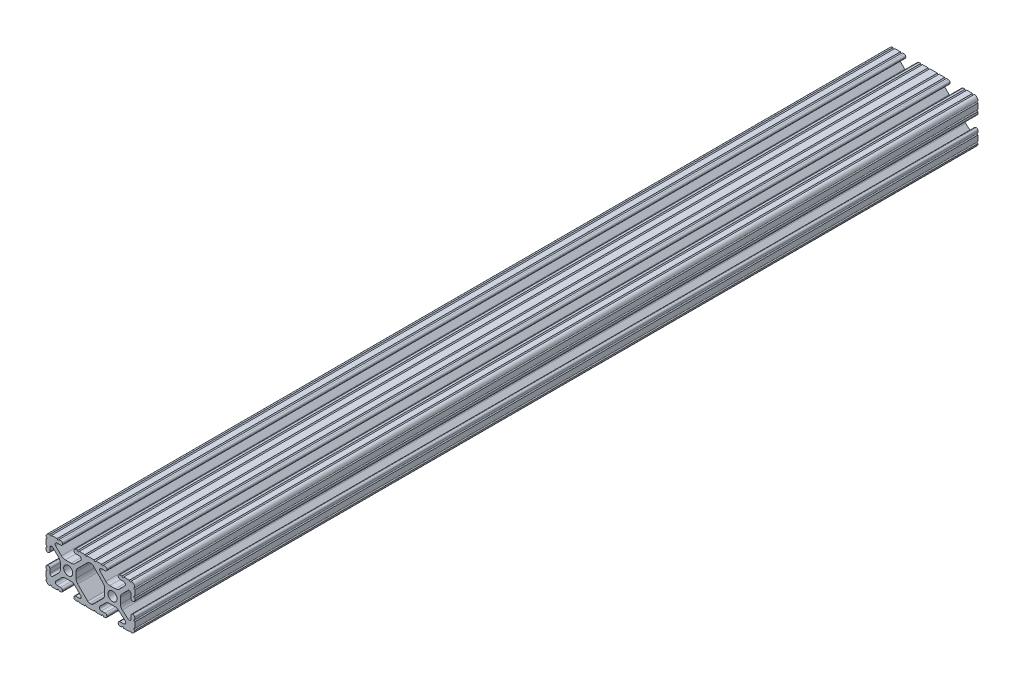
from build123d import *

# Parameters (mm, degrees)
SKETCH1_R           = 2.6035
BOSS_EXTRUDE1_DEPTH = 241.3


with BuildPart() as part:
    # Sketch1 → Boss-Extrude1 (new, symmetric)
    with BuildSketch(Plane.XY):
        with BuildLine():
            Line((18.01710265, 12.7), (16.98745015, 12.7))
            ThreePointArc((16.98745015, 12.7), (16.245730386, 12.392769614), (15.9385, 11.65104985))
            Line((15.9385, 11.65104985), (15.9385, 11.53922))
            ThreePointArc((15.9385, 11.53922), (16.245750844, 10.797450844), (16.98752, 10.4902))
            Line((16.98752, 10.4902), (19.116384363, 10.4902))
            ThreePointArc((19.116384363, 10.4902), (20.052502933, 9.869096983), (19.844087081, 8.765172272))
            Line((19.844087081, 8.765172272), (16.618993479, 5.455112286))
            ThreePointArc((16.618993479, 5.455112286), (15.578994274, 4.745442459), (14.344932584, 4.4958))
            Line((14.344932584, 4.4958), (11.083317835, 4.4958))
            ThreePointArc((11.083317835, 4.4958), (9.854330953, 4.743306833), (8.816955189, 5.447238587))
            Line((8.816955189, 5.447238587), (5.564154119, 8.762652677))
            ThreePointArc((5.564154119, 8.762652677), (5.352591412, 9.867473037), (6.289393385, 10.4902))
            Line((6.289393385, 10.4902), (8.41248, 10.4902))
            ThreePointArc((8.41248, 10.4902), (9.154249156, 10.797450844), (9.4615, 11.53922))
            Line((9.4615, 11.53922), (9.4615, 11.65104985))
            ThreePointArc((9.4615, 11.65104985), (9.154269614, 12.392769614), (8.41254985, 12.7))
            Line((8.41254985, 12.7), (7.38288465, 12.7))
            ThreePointArc((7.38288465, 12.7), (6.87488465, 12.192), (6.36688465, 12.7))
            Line((6.36688465, 12.7), (3.14958095, 12.7))
            ThreePointArc((3.14958095, 12.7), (2.64158095, 12.192), (2.13358095, 12.7))
            Line((2.13358095, 12.7), (-2.13358095, 12.7))
            ThreePointArc((-2.13358095, 12.7), (-2.64158095, 12.192), (-3.14958095, 12.7))
            Line((-3.14958095, 12.7), (-6.36689735, 12.7))
            ThreePointArc((-6.36689735, 12.7), (-6.87489735, 12.192), (-7.38289735, 12.7))
            Line((-7.38289735, 12.7), (-8.41254985, 12.7))
            ThreePointArc((-8.41254985, 12.7), (-9.154269614, 12.392769614), (-9.4615, 11.65104985))
            Line((-9.4615, 11.65104985), (-9.4615, 11.53922))
            ThreePointArc((-9.4615, 11.53922), (-9.154249156, 10.797450844), (-8.41248, 10.4902))
            Line((-8.41248, 10.4902), (-6.283641037, 10.4902))
            ThreePointArc((-6.283641037, 10.4902), (-5.297291557, 9.829633109), (-5.532576693, 8.666071843))
            Line((-5.532576693, 8.666071843), (-8.809985098, 5.416263103))
            ThreePointArc((-8.809985098, 5.416263103), (-9.836720513, 4.734920264), (-11.045536121, 4.4958))
            Line((-11.045536121, 4.4958), (-14.354463879, 4.4958))
            ThreePointArc((-14.354463879, 4.4958), (-15.563279487, 4.734920264), (-16.590014902, 5.416263103))
            Line((-16.590014902, 5.416263103), (-19.867423307, 8.666071843))
            ThreePointArc((-19.867423307, 8.666071843), (-20.102708443, 9.829633109), (-19.116358963, 10.4902))
            Line((-19.116358963, 10.4902), (-16.98752, 10.4902))
            ThreePointArc((-16.98752, 10.4902), (-16.245750844, 10.797450844), (-15.9385, 11.53922))
            Line((-15.9385, 11.53922), (-15.9385, 11.65104985))
            ThreePointArc((-15.9385, 11.65104985), (-16.245730386, 12.392769614), (-16.98745015, 12.7))
            Line((-16.98745015, 12.7), (-18.01711535, 12.7))
            ThreePointArc((-18.01711535, 12.7), (-18.52511535, 12.192), (-19.03311535, 12.7))
            Line((-19.03311535, 12.7), (-22.2504, 12.7))
            ThreePointArc((-22.2504, 12.7), (-22.758323491, 12.192000006), (-23.266399977, 12.699846982))
            ThreePointArc((-23.266399977, 12.699846982), (-24.782522516, 12.082522516), (-25.399846982, 10.566399977))
            ThreePointArc((-25.399846982, 10.566399977), (-24.892000006, 10.058323491), (-25.4, 9.5504))
            Line((-25.4, 9.5504), (-25.4, 6.3330836))
            ThreePointArc((-25.4, 6.3330836), (-24.892, 5.8250836), (-25.4, 5.3170836))
            Line((-25.4, 5.3170836), (-25.4, 4.237520184))
            ThreePointArc((-25.4, 4.237520184), (-25.107393763, 3.531106237), (-24.400979816, 3.2385))
            Line((-24.400979816, 3.2385), (-24.23922, 3.2385))
            ThreePointArc((-24.23922, 3.2385), (-23.497450844, 3.545750844), (-23.1902, 4.28752))
            Line((-23.1902, 4.28752), (-23.1902, 6.334741132))
            ThreePointArc((-23.1902, 6.334741132), (-22.556026952, 7.286023527), (-21.434002553, 7.066535717))
            Line((-21.434002553, 7.066535717), (-18.147950853, 3.808156468))
            ThreePointArc((-18.147950853, 3.808156468), (-17.452759693, 2.774838327), (-17.208501877, 1.553619571))
            Line((-17.208501877, 1.553619571), (-17.208501877, -1.695179196))
            ThreePointArc((-17.208501877, -1.695179196), (-17.450738657, -2.911536421), (-18.140486065, -3.942289578))
            Line((-18.140486065, -3.942289578), (-21.431579576, -7.227386226))
            ThreePointArc((-21.431579576, -7.227386226), (-22.55444896, -7.449940594), (-23.1902, -6.498002195))
            Line((-23.1902, -6.498002195), (-23.1902, -4.28752))
            ThreePointArc((-23.1902, -4.28752), (-23.497450844, -3.545750844), (-24.23922, -3.2385))
            Line((-24.23922, -3.2385), (-24.35098, -3.2385))
            ThreePointArc((-24.35098, -3.2385), (-25.092749156, -3.545750844), (-25.4, -4.28752))
            Line((-25.4, -4.28752), (-25.4, -5.3171344))
            ThreePointArc((-25.4, -5.3171344), (-24.892, -5.8251344), (-25.4, -6.3331344))
            Line((-25.4, -6.3331344), (-25.4, -9.5504))
            ThreePointArc((-25.4, -9.5504), (-24.892000006, -10.058323491), (-25.399846982, -10.566399977))
            ThreePointArc((-25.399846982, -10.566399977), (-24.782522516, -12.082522516), (-23.266399977, -12.699846982))
            ThreePointArc((-23.266399977, -12.699846982), (-22.758323491, -12.192000006), (-22.2504, -12.7))
            Line((-22.2504, -12.7), (-19.03308995, -12.7))
            ThreePointArc((-19.03308995, -12.7), (-18.52508995, -12.192), (-18.01708995, -12.7))
            Line((-18.01708995, -12.7), (-16.9874692, -12.7))
            ThreePointArc((-16.9874692, -12.7), (-16.245700044, -12.392749156), (-15.9384492, -11.65098))
            Line((-15.9384492, -11.65098), (-15.9384492, -11.53922))
            ThreePointArc((-15.9384492, -11.53922), (-16.245700044, -10.797450844), (-16.9874692, -10.4902))
            Line((-16.9874692, -10.4902), (-19.116358963, -10.4902))
            ThreePointArc((-19.116358963, -10.4902), (-20.055197748, -9.862578342), (-19.834124023, -8.755124678))
            Line((-19.834124023, -8.755124678), (-16.49660751, -5.423689618))
            ThreePointArc((-16.49660751, -5.423689618), (-15.467274017, -4.736928798), (-14.253591699, -4.4958))
            Line((-14.253591699, -4.4958), (-11.146408301, -4.4958))
            ThreePointArc((-11.146408301, -4.4958), (-9.932725983, -4.736928798), (-8.90339249, -5.423689618))
            Line((-8.90339249, -5.423689618), (-5.565875977, -8.755124678))
            ThreePointArc((-5.565875977, -8.755124678), (-5.344802252, -9.862578342), (-6.283641037, -10.4902))
            Line((-6.283641037, -10.4902), (-8.4125308, -10.4902))
            ThreePointArc((-8.4125308, -10.4902), (-9.154299956, -10.797450844), (-9.4615508, -11.53922))
            Line((-9.4615508, -11.53922), (-9.4615508, -11.65098))
            ThreePointArc((-9.4615508, -11.65098), (-9.154299956, -12.392749156), (-8.4125308, -12.7))
            Line((-8.4125308, -12.7), (-7.38287195, -12.7))
            ThreePointArc((-7.38287195, -12.7), (-6.87487195, -12.192), (-6.36687195, -12.7))
            Line((-6.36687195, -12.7), (-3.14960635, -12.7))
            ThreePointArc((-3.14960635, -12.7), (-2.64160635, -12.192), (-2.13360635, -12.7))
            Line((-2.13360635, -12.7), (2.13360635, -12.7))
            ThreePointArc((2.13360635, -12.7), (2.64159365, -12.1920127), (3.14958095, -12.7))
            Line((3.14958095, -12.7), (6.36691005, -12.7))
            ThreePointArc((6.36691005, -12.7), (6.87491005, -12.192), (7.38291005, -12.7))
            Line((7.38291005, -12.7), (8.4125308, -12.7))
            ThreePointArc((8.4125308, -12.7), (9.154299956, -12.392749156), (9.4615508, -11.65098))
            Line((9.4615508, -11.65098), (9.4615508, -11.53922))
            ThreePointArc((9.4615508, -11.53922), (9.154299956, -10.797450844), (8.4125308, -10.4902))
            Line((8.4125308, -10.4902), (6.289393385, -10.4902))
            ThreePointArc((6.289393385, -10.4902), (5.231590322, -9.783049717), (5.480677245, -8.535265862))
            Line((5.480677245, -8.535265862), (8.597933595, -5.423689618))
            ThreePointArc((8.597933595, -5.423689618), (9.627267088, -4.736928798), (10.840949406, -4.4958))
            Line((10.840949406, -4.4958), (14.102564155, -4.4958))
            ThreePointArc((14.102564155, -4.4958), (15.215927525, -4.697410182), (16.187895372, -5.276636531))
            Line((16.187895372, -5.276636531), (19.868247549, -8.482246082))
            ThreePointArc((19.868247549, -8.482246082), (20.188435806, -9.746879864), (19.116384363, -10.4902))
            Line((19.116384363, -10.4902), (16.9874692, -10.4902))
            ThreePointArc((16.9874692, -10.4902), (16.245700044, -10.797450844), (15.9384492, -11.53922))
            Line((15.9384492, -11.53922), (15.9384492, -11.65098))
            ThreePointArc((15.9384492, -11.65098), (16.245700044, -12.392749156), (16.9874692, -12.7))
            Line((16.9874692, -12.7), (18.01710265, -12.7))
            ThreePointArc((18.01710265, -12.7), (18.52510265, -12.192), (19.03310265, -12.7))
            Line((19.03310265, -12.7), (22.2504, -12.7))
            ThreePointArc((22.2504, -12.7), (22.758323491, -12.192000006), (23.266399977, -12.699846982))
            ThreePointArc((23.266399977, -12.699846982), (24.782522516, -12.082522516), (25.399846982, -10.566399977))
            ThreePointArc((25.399846982, -10.566399977), (24.892000006, -10.058323492), (25.4, -9.550400001))
            Line((25.4, -9.550400001), (25.4, -6.333083592))
            ThreePointArc((25.4, -6.333083592), (24.892000001, -5.825083593), (25.4, -5.317083593))
            Line((25.4, -5.317083593), (25.4, -4.237520184))
            ThreePointArc((25.4, -4.237520184), (25.107393763, -3.531106237), (24.400979816, -3.2385))
            Line((24.400979816, -3.2385), (24.189220184, -3.2385))
            ThreePointArc((24.189220184, -3.2385), (23.482806237, -3.531106237), (23.1902, -4.237520184))
            Line((23.1902, -4.237520184), (23.1902, -6.155876159))
            ThreePointArc((23.1902, -6.155876159), (22.62232736, -7.038258539), (21.583974541, -6.886926384))
            Line((21.583974541, -6.886926384), (18.29817066, -4.024970844))
            ThreePointArc((18.29817066, -4.024970844), (17.493730985, -2.946044689), (17.208501877, -1.630807374))
            Line((17.208501877, -1.630807374), (17.208501877, 1.630807374))
            ThreePointArc((17.208501877, 1.630807374), (17.442348332, 2.82673414), (18.109440981, 3.846495088))
            Line((18.109440981, 3.846495088), (21.526346532, 7.353420386))
            ThreePointArc((21.526346532, 7.353420386), (22.585896263, 7.574939077), (23.1902, 6.676867167))
            Line((23.1902, 6.676867167), (23.1902, 4.237520184))
            ThreePointArc((23.1902, 4.237520184), (23.482806237, 3.531106237), (24.189220184, 3.2385))
            Line((24.189220184, 3.2385), (24.400979816, 3.2385))
            ThreePointArc((24.400979816, 3.2385), (25.107393763, 3.531106237), (25.4, 4.237520184))
            Line((25.4, 4.237520184), (25.4, 5.3170836))
            ThreePointArc((25.4, 5.3170836), (24.891949193, 5.825134407), (25.4, 6.333185215))
            Line((25.4, 6.333185215), (25.4, 9.550400015))
            ThreePointArc((25.4, 9.550400015), (24.892000013, 10.058323498), (25.399846982, 10.566399977))
            ThreePointArc((25.399846982, 10.566399977), (24.782522516, 12.082522516), (23.266399977, 12.699846982))
            ThreePointArc((23.266399977, 12.699846982), (22.758323491, 12.192000006), (22.2504, 12.7))
            Line((22.2504, 12.7), (19.03310265, 12.7))
            ThreePointArc((19.03310265, 12.7), (18.52510265, 12.192), (18.01710265, 12.7))
        make_face()
        with Locations(Location((-12.7, 0, 0), (0, 0, 180))):
            Circle(SKETCH1_R, mode=Mode.SUBTRACT)
        with Locations(Location((12.7, 0, 0), (0, 0, 180))):
            Circle(SKETCH1_R, mode=Mode.SUBTRACT)
        with BuildLine():
            Line((-7.259513935, -3.869413038), (-1.545748891, -9.572766749))
            ThreePointArc((-1.545748891, -9.572766749), (-1.035199478, -9.913400116), (-0.433213048, -10.033))
            Line((-0.433213048, -10.033), (0.433213048, -10.033))
            ThreePointArc((0.433213048, -10.033), (1.035199478, -9.913400116), (1.545748891, -9.572766749))
            Line((1.545748891, -9.572766749), (7.259513935, -3.869413038))
            ThreePointArc((7.259513935, -3.869413038), (7.949261343, -2.838659881), (8.191498123, -1.622302656))
            Line((8.191498123, -1.622302656), (8.191498123, 1.622302656))
            ThreePointArc((8.191498123, 1.622302656), (7.955573352, 2.823327967), (7.282860769, 3.845864069))
            Line((7.282860769, 3.845864069), (1.675572808, 9.561086461))
            ThreePointArc((1.675572808, 9.561086461), (1.161034429, 9.910236611), (0.551456936, 10.033))
            Line((0.551456936, 10.033), (-0.395199982, 10.033))
            ThreePointArc((-0.395199982, 10.033), (-0.994772524, 9.914396349), (-1.50403329, 9.576450301))
            Line((-1.50403329, 9.576450301), (-7.252049147, 3.876839553))
            ThreePointArc((-7.252049147, 3.876839553), (-7.947240307, 2.843521412), (-8.191498123, 1.622302656))
            Line((-8.191498123, 1.622302656), (-8.191498123, -1.622302656))
            ThreePointArc((-8.191498123, -1.622302656), (-7.949261343, -2.838659881), (-7.259513935, -3.869413038))
        make_face(mode=Mode.SUBTRACT)
    extrude(amount=BOSS_EXTRUDE1_DEPTH, both=True)


solid = part.part
